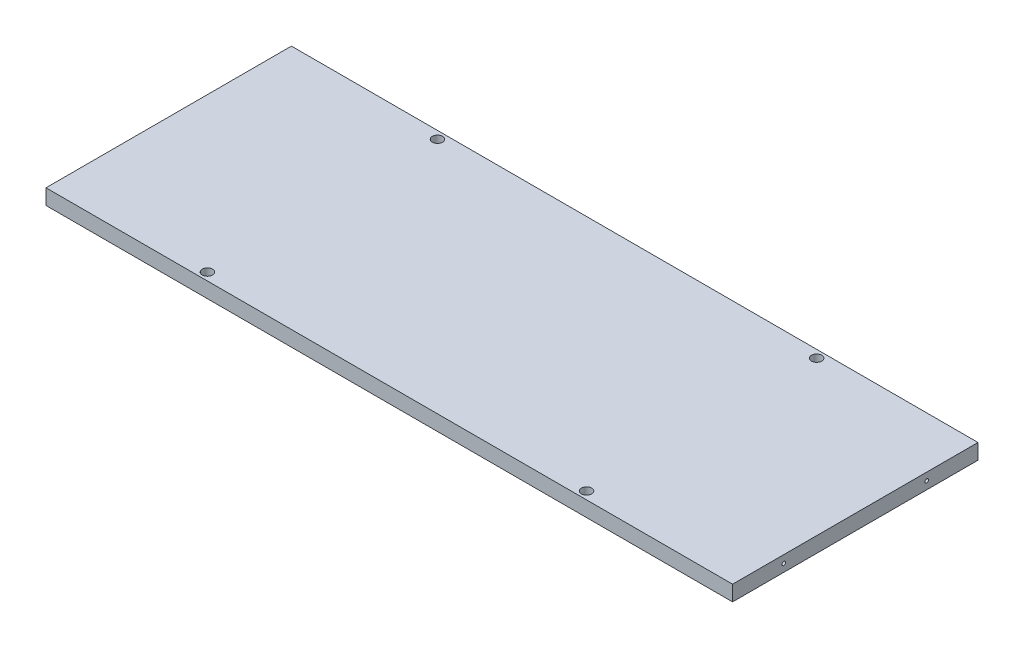
from build123d import *

# Parameters (mm, degrees)
SKETCH_1_W          = 134
SKETCH_1_H          = 3
EXTRUDE_1_DEPTH     = 47.9
SKETCH_4_R          = 0.7
CUT_EXTRUDE_1_DEPTH = 83.416078528
SKETCH_4_3_R        = 1
CUT_EXTRUDE_2_DEPTH = 1.5
SKETCH_5_R          = 0.35
CUT_EXTRUDE_3_DEPTH = 1.5
SKETCH_6_R          = 0.35
CUT_EXTRUDE_4_DEPTH = 1.5
CUT_EXTRUDE_START   = -132.5
SKETCH_6_3_R        = 0.35
CUT_EXTRUDE_5_DEPTH = 1.5


with BuildPart() as part:
    # 草图1 → 凸台-拉伸1 (new body)
    with BuildSketch(Plane.XY):
        Rectangle(SKETCH_1_W, SKETCH_1_H)
    extrude(amount=EXTRUDE_1_DEPTH)

    # 草图4 → 切除-拉伸1 (cut, through all)
    with BuildSketch(Plane(origin=(0, 1.5, 0), x_dir=(1, 0, 0), z_dir=(0, 1, 0))):
        with Locations(Location((-37, -46.4, 0), (0, 0, 270))):
            Circle(SKETCH_4_R)
        with Locations(Location((37, -46.4, 0), (0, 0, 270))):
            Circle(SKETCH_4_R)
        with Locations(Location((-37, -1.5, 0), (0, 0, 270))):
            Circle(SKETCH_4_R)
        with Locations(Location((37, -1.5, 0), (0, 0, 270))):
            Circle(SKETCH_4_R)
    extrude(amount=-CUT_EXTRUDE_1_DEPTH, mode=Mode.SUBTRACT)

    # 草图4<3> → 切除-拉伸2 (cut)
    with BuildSketch(Plane(origin=(0, 1.5, 0), x_dir=(1, 0, 0), z_dir=(0, 1, 0))):
        with Locations(Location((-37, -46.4, 0), (0, 0, 270))):
            Circle(SKETCH_4_3_R)
        with Locations(Location((37, -46.4, 0), (0, 0, 270))):
            Circle(SKETCH_4_3_R)
        with Locations(Location((37, -1.5, 0), (0, 0, 270))):
            Circle(SKETCH_4_3_R)
        with Locations(Location((-37, -1.5, 0), (0, 0, 270))):
            Circle(SKETCH_4_3_R)
    extrude(amount=-CUT_EXTRUDE_2_DEPTH, mode=Mode.SUBTRACT)

    # 草图5 → 切除-拉伸3 (cut)
    with BuildSketch(Plane.XZ.offset(1.5)):
        with Locations((-42.3, 22.35)):
            Circle(SKETCH_5_R)
        with Locations((42.3, 22.35)):
            Circle(SKETCH_5_R)
    extrude(amount=-CUT_EXTRUDE_3_DEPTH, mode=Mode.SUBTRACT)

    # 草图6 → 切除-拉伸4 (cut)
    with BuildSketch(Plane(origin=(67, 0, 0), x_dir=(0, 0, -1), z_dir=(1, 0, 0))):
        with Locations((-37.9, 0)):
            Circle(SKETCH_6_R)
        with Locations((-10, 0)):
            Circle(SKETCH_6_R)
    extrude(amount=-CUT_EXTRUDE_4_DEPTH, mode=Mode.SUBTRACT)

    # 草图6<3> → 切除-拉伸5 (cut)
    with BuildSketch(Plane(origin=(67, 0, 0), x_dir=(0, 0, -1), z_dir=(1, 0, 0)).offset(CUT_EXTRUDE_START)):
        with Locations((-37.9, 0)):
            Circle(SKETCH_6_3_R)
        with Locations((-10, 0)):
            Circle(SKETCH_6_3_R)
    extrude(amount=-CUT_EXTRUDE_5_DEPTH, mode=Mode.SUBTRACT)


solid = part.part
